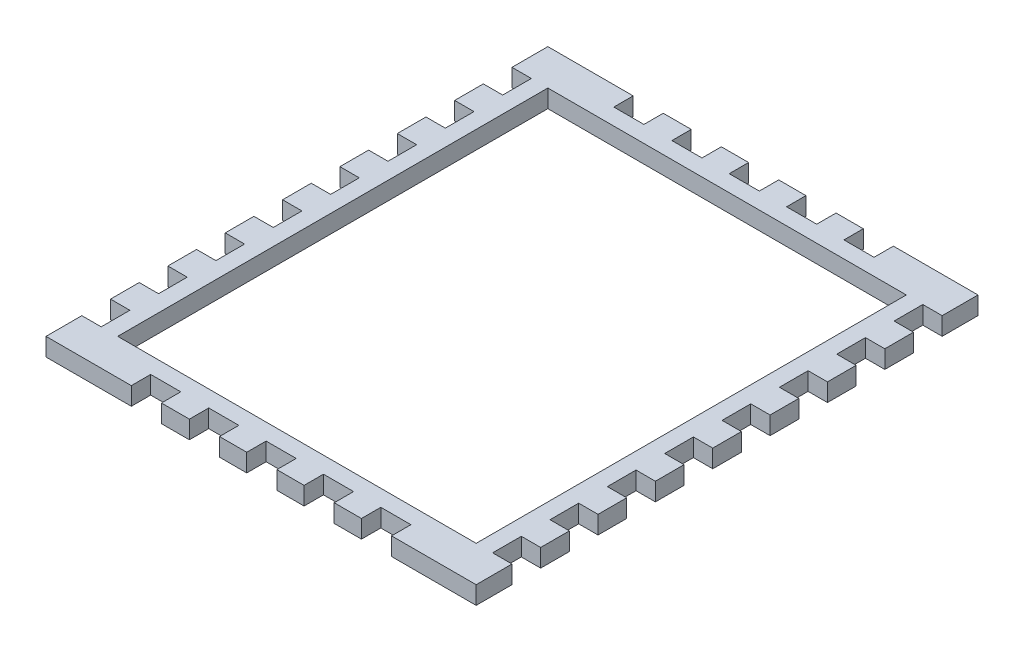
from build123d import *

# Parameters (mm, degrees)
SKETCH1_W           = 76.2
SKETCH1_H           = 88.9
SKETCH1_W_2         = 63.5
SKETCH1_H_2         = 76.2
BOSS_EXTRUDE1_DEPTH = 3.175
SKETCH2_W           = 5.334
SKETCH2_H           = 3.429
SKETCH2_W_2         = 3.429
SKETCH2_H_2         = 5.08
CUT_EXTRUDE1_DEPTH  = 59.630138368


with BuildPart() as part:
    # Sketch1 → Boss-Extrude1 (new body)
    with BuildSketch(Plane(origin=(0, 0, 0), x_dir=(1, 0, 0), z_dir=(0, 1, 0))):
        Rectangle(SKETCH1_W, SKETCH1_H)
        Rectangle(SKETCH1_W_2, SKETCH1_H_2, mode=Mode.SUBTRACT)
    extrude(amount=BOSS_EXTRUDE1_DEPTH)

    # Sketch2 → Cut-Extrude1 (cut, through all)
    with BuildSketch(Plane(origin=(0, 0, 0), x_dir=(1, 0, 0), z_dir=(0, 1, 0))):
        with Locations((20.447, -42.7355)):
            Rectangle(SKETCH2_W, SKETCH2_H)
        with Locations((10.287, -42.7355)):
            Rectangle(SKETCH2_W, SKETCH2_H)
        with Locations((0.127, -42.7355)):
            Rectangle(SKETCH2_W, SKETCH2_H)
        with Locations((-10.033, -42.7355)):
            Rectangle(SKETCH2_W, SKETCH2_H)
        with Locations((-20.32, -42.7355)):
            Rectangle(SKETCH2_W, SKETCH2_H)
        with Locations((-36.3855, 35.56)):
            Rectangle(SKETCH2_W_2, SKETCH2_H_2)
        with Locations((-36.3855, 25.4)):
            Rectangle(SKETCH2_W_2, SKETCH2_H_2)
        with Locations((-36.3855, 15.24)):
            Rectangle(SKETCH2_W_2, SKETCH2_H_2)
        with Locations((-36.3855, 5.08)):
            Rectangle(SKETCH2_W_2, SKETCH2_H_2)
        with Locations((-36.3855, -5.08)):
            Rectangle(SKETCH2_W_2, SKETCH2_H_2)
        with Locations((-36.3855, -15.24)):
            Rectangle(SKETCH2_W_2, SKETCH2_H_2)
        with Locations((-36.3855, -25.4)):
            Rectangle(SKETCH2_W_2, SKETCH2_H_2)
        with Locations((-36.3855, -35.56)):
            Rectangle(SKETCH2_W_2, SKETCH2_H_2)
        with Locations((36.3855, -35.56)):
            Rectangle(SKETCH2_W_2, SKETCH2_H_2)
        with Locations((36.3855, -25.4)):
            Rectangle(SKETCH2_W_2, SKETCH2_H_2)
        with Locations((36.3855, -15.24)):
            Rectangle(SKETCH2_W_2, SKETCH2_H_2)
        with Locations((36.3855, -5.08)):
            Rectangle(SKETCH2_W_2, SKETCH2_H_2)
        with Locations((36.3855, 5.08)):
            Rectangle(SKETCH2_W_2, SKETCH2_H_2)
        with Locations((36.3855, 15.24)):
            Rectangle(SKETCH2_W_2, SKETCH2_H_2)
        with Locations((36.3855, 25.4)):
            Rectangle(SKETCH2_W_2, SKETCH2_H_2)
        with Locations((36.3855, 35.56)):
            Rectangle(SKETCH2_W_2, SKETCH2_H_2)
        with Locations((-20.32, 42.7355)):
            Rectangle(SKETCH2_W, SKETCH2_H)
        with Locations((-10.033, 42.7355)):
            Rectangle(SKETCH2_W, SKETCH2_H)
        with Locations((0.127, 42.7355)):
            Rectangle(SKETCH2_W, SKETCH2_H)
        with Locations((10.287, 42.7355)):
            Rectangle(SKETCH2_W, SKETCH2_H)
        with Locations((20.447, 42.7355)):
            Rectangle(SKETCH2_W, SKETCH2_H)
    extrude(amount=CUT_EXTRUDE1_DEPTH, mode=Mode.SUBTRACT)


solid = part.part
